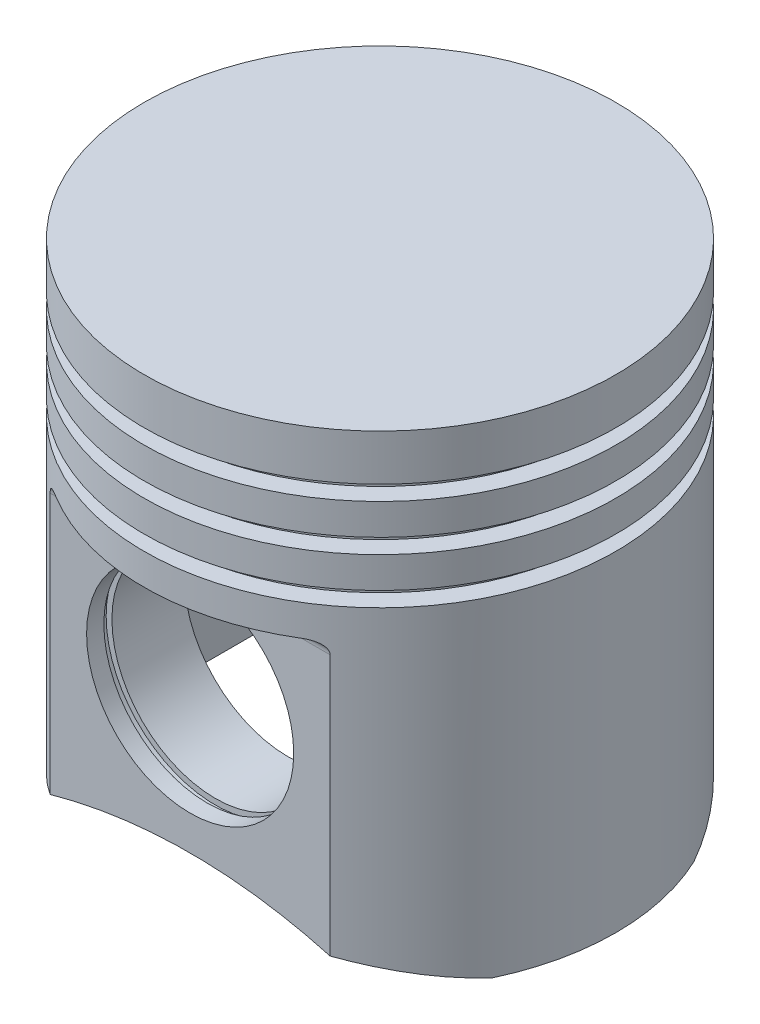
from build123d import *

# Parameters (mm, degrees)
CUT_EXTRUDE_1_DEPTH      = 78.884529914
CUT_EXTRUDE_1_DEPTH_BACK = 78.884529914
SKETCH_2_R               = 18
CUT_EXTRUDE_2_DEPTH      = 16
CUT_EXTRUDE_3_DEPTH      = 78.88453002
CUT_EXTRUDE_3_DEPTH_BACK = 78.88453002
SKETCH_5_W               = 1.4
SKETCH_5_H               = 1


with BuildPart() as part:
    # Эскиз1 → Повернуть1 (revolve)
    with BuildSketch(Plane.XY):
        Polygon((-41, 52), (0, 52), (0, -32), (-41, -32), (-41, 25.4), (-37.8, 25.4), (-37.8, 28), (-41, 28), (-41, 33.4), (-37.8, 33.4), (-37.8, 36), (-41, 36), (-41, 41.4), (-37.8, 41.4), (-37.8, 44), (-41, 44), align=None)
    revolve(axis=Axis((0, 61.035043516, 0), (0, -1, 0)))

    # Эскиз2 → Вырез-Вытянуть1 (cut, two sides: drawn at the far end of the back side and taken through both)
    with BuildSketch(Plane.XY.offset(-CUT_EXTRUDE_1_DEPTH_BACK)):
        Circle(SKETCH_2_R)
        with BuildLine():
            Line((-37.094473982, -32), (37.094473982, -32))
            ThreePointArc((37.094473982, -32), (0, -24), (-37.094473982, -32))
        make_face()
    extrude(amount=CUT_EXTRUDE_1_DEPTH + CUT_EXTRUDE_1_DEPTH_BACK, mode=Mode.SUBTRACT)

    # Эскиз3 → Вырез-Вытянуть2 (cut, symmetric)
    with BuildSketch(Plane.XY):
        with BuildLine():
            Line((-34.154400713, -32), (-29.776384549, 3.656080302))
            ThreePointArc((-29.776384549, 3.656080302), (0, 30), (29.776384549, 3.656080302))
            Line((29.776384549, 3.656080302), (34.154400713, -32))
            Line((34.154400713, -32), (-34.154400713, -32))
        make_face()
    extrude(amount=CUT_EXTRUDE_2_DEPTH, both=True, mode=Mode.SUBTRACT)

    # Эскиз4 → Вырез-Вытянуть3 (cut, two sides: drawn at the far end of the back side and taken through both)
    with BuildSketch(Plane(origin=(0, 0, 0), x_dir=(0, 0, -1), z_dir=(1, 0, 0)).offset(-CUT_EXTRUDE_3_DEPTH_BACK)):
        with BuildLine():
            Line((-41, -32), (-33, -32))
            Line((-33, -32), (-33, 18))
            ThreePointArc((-33, 18), (-33.585786438, 19.414213562), (-35, 20))
            Line((-35, 20), (-41, 20))
            Line((-41, 20), (-41, -32))
        make_face()
        with BuildLine():
            Line((33, -32), (33, 18))
            ThreePointArc((33, 18), (33.585786438, 19.414213562), (35, 20))
            Line((35, 20), (41, 20))
            Line((41, 20), (41, -32))
            Line((41, -32), (33, -32))
        make_face()
    extrude(amount=CUT_EXTRUDE_3_DEPTH + CUT_EXTRUDE_3_DEPTH_BACK, mode=Mode.SUBTRACT)

    # Эскиз5 → Вырез-Повернуть1 (revolve, cut)
    with BuildSketch(Plane(origin=(0, 0, 0), x_dir=(0, 0, -1), z_dir=(1, 0, 0)), mode=Mode.PRIVATE) as cut_revolve_1_sk:
        with Locations((29.3, -18.5)):
            Rectangle(SKETCH_5_W, SKETCH_5_H)
        with Locations((-29.3, -18.5)):
            Rectangle(SKETCH_5_W, SKETCH_5_H)
    revolve(cut_revolve_1_sk.sketch.rotate(Axis((0, 0, 40.792042143), (0, 0, -1)), 270), axis=Axis((0, 0, 40.792042143), (0, 0, -1)), mode=Mode.SUBTRACT)


solid = part.part
